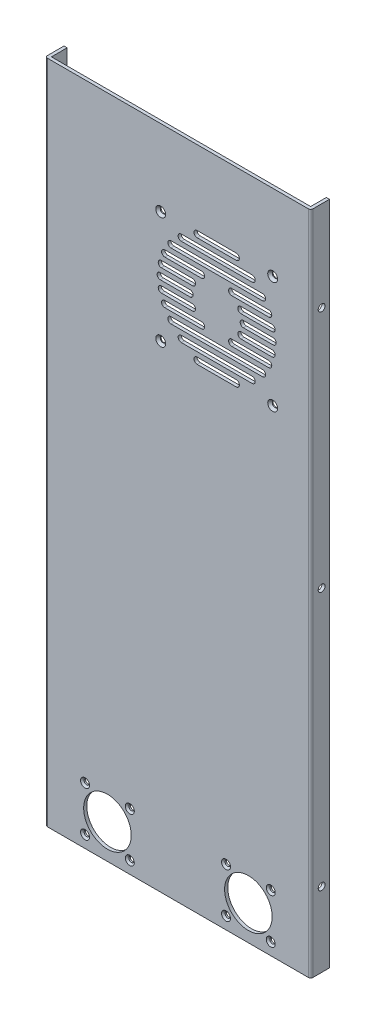
from build123d import *

# Parameters (mm, degrees)
EXTRUDE_THIN1_DEPTH                               = 425
SKETCH2_R                                         = 1
SKETCH2_R_2                                       = 15.187
CUT_EXTRUDE1_DEPTH                                = 10
SKETCH3_R                                         = 2.195
CUT_EXTRUDE2_DEPTH                                = 458.71088036
CSK_FOR_4_FLAT_HEAD_MACHINE_SCREW_100_D           = 3.2639
CSK_FOR_4_FLAT_HEAD_MACHINE_SCREW_100_DEPTH       = 10
CSK_FOR_4_FLAT_HEAD_MACHINE_SCREW_100_CSINK_D     = 5.715
CSK_FOR_4_FLAT_HEAD_MACHINE_SCREW_100_CSINK_ANGLE = 100
CSK_FOR_4_FLAT_HEAD_MACHINE_SCREW_100_TIP         = 0.980574487
CSK_FOR_M3_FLAT_HEAD_MACHINE_SCREW1_D             = 3.4
CSK_FOR_M3_FLAT_HEAD_MACHINE_SCREW1_DEPTH         = 10
CSK_FOR_M3_FLAT_HEAD_MACHINE_SCREW1_CSINK_D       = 6.3
CSK_FOR_M3_FLAT_HEAD_MACHINE_SCREW1_CSINK_ANGLE   = 90
CSK_FOR_M3_FLAT_HEAD_MACHINE_SCREW1_TIP           = 1.021463052


with BuildPart() as part:
    # Sketch1 → Extrude-Thin1 (new body)
    with BuildSketch(Plane(origin=(0, 0, 0), x_dir=(1, 0, 0), z_dir=(0, 1, 0))):
        with BuildLine():
            Line((-84.75, 12), (-84.75, 1.5))
            ThreePointArc((-84.75, 1.5), (-84.310660172, 0.439339828), (-83.25, 0))
            Line((-83.25, 0), (83.25, 0))
            ThreePointArc((83.25, 0), (84.310660172, 0.439339828), (84.75, 1.5))
            Line((84.75, 1.5), (84.75, 12))
            Line((84.75, 12), (82.75, 12))
            Line((82.75, 12), (82.75, 2))
            Line((82.75, 2), (-82.75, 2))
            Line((-82.75, 2), (-82.75, 12))
            Line((-82.75, 12), (-84.75, 12))
        make_face()
    extrude(amount=EXTRUDE_THIN1_DEPTH)

    # Sketch2 → Cut-Extrude1 (cut)
    with BuildSketch(Plane(origin=(0, 0, -2), x_dir=(-1, 0, 0), z_dir=(0, 0, -1))):
        with Locations((-60.5, 376.25)):
            Circle(SKETCH2_R)
        with Locations((11, 376.25)):
            Circle(SKETCH2_R)
        with Locations((-60.5, 304.75)):
            Circle(SKETCH2_R)
        with Locations((11, 304.75)):
            Circle(SKETCH2_R)
        with Locations((45, 22)):
            Circle(SKETCH2_R_2)
        with Locations((-45, 22)):
            Circle(SKETCH2_R_2)
        with Locations((-59.2875, 7.7125)):
            Circle(SKETCH2_R)
        with Locations((-30.7125, 7.7125)):
            Circle(SKETCH2_R)
        with Locations((-30.7125, 36.2875)):
            Circle(SKETCH2_R)
        with Locations((-59.2875, 36.2875)):
            Circle(SKETCH2_R)
        with Locations((30.7125, 36.2875)):
            Circle(SKETCH2_R)
        with Locations((59.2875, 36.2875)):
            Circle(SKETCH2_R)
        with Locations((59.2875, 7.7125)):
            Circle(SKETCH2_R)
        with Locations((30.7125, 7.7125)):
            Circle(SKETCH2_R)
        with BuildLine():
            Line((-60.75, 342.5), (-41.75, 342.5))
            ThreePointArc((-41.75, 342.5), (-39.75, 340.5), (-41.75, 338.5))
            Line((-41.75, 338.5), (-60.75, 338.5))
            ThreePointArc((-60.75, 338.5), (-62.75, 340.5), (-60.75, 342.5))
        make_face()
        with BuildLine():
            Line((-7.75, 342.5), (11.25, 342.5))
            ThreePointArc((11.25, 342.5), (13.25, 340.5), (11.25, 338.5))
            Line((11.25, 338.5), (-7.75, 338.5))
            ThreePointArc((-7.75, 338.5), (-9.75, 340.5), (-7.75, 342.5))
        make_face()
        with BuildLine():
            Line((-60.062887166, 349.5), (-40.241933385, 349.5))
            ThreePointArc((-40.241933385, 349.5), (-38.241933385, 347.5), (-40.241933385, 345.5))
            Line((-40.241933385, 345.5), (-60.062887166, 345.5))
            ThreePointArc((-60.062887166, 345.5), (-62.062887166, 347.5), (-60.062887166, 349.5))
        make_face()
        with BuildLine():
            Line((-57.916247904, 356.5), (-34.393650761, 356.5))
            ThreePointArc((-34.393650761, 356.5), (-32.393650761, 354.5), (-34.393650761, 352.5))
            Line((-34.393650761, 352.5), (-57.916247904, 352.5))
            ThreePointArc((-57.916247904, 352.5), (-59.916247904, 354.5), (-57.916247904, 356.5))
        make_face()
        with BuildLine():
            Line((-9.258066615, 349.5), (10.562887166, 349.5))
            ThreePointArc((10.562887166, 349.5), (12.562887166, 347.5), (10.562887166, 345.5))
            Line((10.562887166, 345.5), (-9.258066615, 345.5))
            ThreePointArc((-9.258066615, 345.5), (-11.258066615, 347.5), (-9.258066615, 349.5))
        make_face()
        with BuildLine():
            Line((-15.106349239, 356.5), (8.416247904, 356.5))
            ThreePointArc((8.416247904, 356.5), (10.416247904, 354.5), (8.416247904, 352.5))
            Line((8.416247904, 352.5), (-15.106349239, 352.5))
            ThreePointArc((-15.106349239, 352.5), (-17.106349239, 354.5), (-15.106349239, 356.5))
        make_face()
        with BuildLine():
            Line((-9.258066615, 335.5), (10.562887166, 335.5))
            ThreePointArc((10.562887166, 335.5), (12.562887166, 333.5), (10.562887166, 331.5))
            Line((10.562887166, 331.5), (-9.258066615, 331.5))
            ThreePointArc((-9.258066615, 331.5), (-11.258066615, 333.5), (-9.258066615, 335.5))
        make_face()
        with BuildLine():
            Line((-15.106349239, 328.5), (8.416247904, 328.5))
            ThreePointArc((8.416247904, 328.5), (10.416247904, 326.5), (8.416247904, 324.5))
            Line((8.416247904, 324.5), (-15.106349239, 324.5))
            ThreePointArc((-15.106349239, 324.5), (-17.106349239, 326.5), (-15.106349239, 328.5))
        make_face()
        with BuildLine():
            Line((-60.062887166, 335.5), (-40.241933385, 335.5))
            ThreePointArc((-40.241933385, 335.5), (-38.241933385, 333.5), (-40.241933385, 331.5))
            Line((-40.241933385, 331.5), (-60.062887166, 331.5))
            ThreePointArc((-60.062887166, 331.5), (-62.062887166, 333.5), (-60.062887166, 335.5))
        make_face()
        with BuildLine():
            Line((-57.916247904, 328.5), (-34.393650761, 328.5))
            ThreePointArc((-34.393650761, 328.5), (-32.393650761, 326.5), (-34.393650761, 324.5))
            Line((-34.393650761, 324.5), (-57.916247904, 324.5))
            ThreePointArc((-57.916247904, 324.5), (-59.916247904, 326.5), (-57.916247904, 328.5))
        make_face()
        with BuildLine():
            Line((-53.990383034, 363.5), (4.490383034, 363.5))
            ThreePointArc((4.490383034, 363.5), (6.490383034, 361.5), (4.490383034, 359.5))
            Line((4.490383034, 359.5), (-53.990383034, 359.5))
            ThreePointArc((-53.990383034, 359.5), (-55.990383034, 361.5), (-53.990383034, 363.5))
        make_face()
        with BuildLine():
            Line((-47.377416998, 370.5), (-2.122583002, 370.5))
            ThreePointArc((-2.122583002, 370.5), (-0.122583002, 368.5), (-2.122583002, 366.5))
            Line((-2.122583002, 366.5), (-47.377416998, 366.5))
            ThreePointArc((-47.377416998, 366.5), (-49.377416998, 368.5), (-47.377416998, 370.5))
        make_face()
        with BuildLine():
            Line((-37.25, 377.5), (-12.25, 377.5))
            ThreePointArc((-12.25, 377.5), (-10.25, 375.5), (-12.25, 373.5))
            Line((-12.25, 373.5), (-37.25, 373.5))
            ThreePointArc((-37.25, 373.5), (-39.25, 375.5), (-37.25, 377.5))
        make_face()
        with BuildLine():
            Line((-53.990383034, 321.5), (4.490383034, 321.5))
            ThreePointArc((4.490383034, 321.5), (6.490383034, 319.5), (4.490383034, 317.5))
            Line((4.490383034, 317.5), (-53.990383034, 317.5))
            ThreePointArc((-53.990383034, 317.5), (-55.990383034, 319.5), (-53.990383034, 321.5))
        make_face()
        with BuildLine():
            Line((-47.377416998, 314.5), (-2.122583002, 314.5))
            ThreePointArc((-2.122583002, 314.5), (-0.122583002, 312.5), (-2.122583002, 310.5))
            Line((-2.122583002, 310.5), (-47.377416998, 310.5))
            ThreePointArc((-47.377416998, 310.5), (-49.377416998, 312.5), (-47.377416998, 314.5))
        make_face()
        with BuildLine():
            Line((-37.25, 307.5), (-12.25, 307.5))
            ThreePointArc((-12.25, 307.5), (-10.25, 305.5), (-12.25, 303.5))
            Line((-12.25, 303.5), (-37.25, 303.5))
            ThreePointArc((-37.25, 303.5), (-39.25, 305.5), (-37.25, 307.5))
        make_face()
    extrude(amount=-CUT_EXTRUDE1_DEPTH, mode=Mode.SUBTRACT)

    # Sketch3 → Cut-Extrude2 (cut, through all)
    with BuildSketch(Plane.ZY.offset(84.75)):
        with Locations((-7, 367.5)):
            Circle(SKETCH3_R)
        with Locations((-7, 212.5)):
            Circle(SKETCH3_R)
        with Locations((-7, 47.5)):
            Circle(SKETCH3_R)
    extrude(amount=-CUT_EXTRUDE2_DEPTH, mode=Mode.SUBTRACT)

    # CSK for #4 Flat Head Machine Screw (100)1
    with Locations(Plane.XY):
        with Locations((-59.2875, 36.2875), (-59.2875, 7.7125), (-30.7125, 7.7125), (-30.7125, 36.2875), (30.7125, 36.2875), (59.2875, 36.2875), (59.2875, 7.7125), (30.7125, 7.7125)):
            CounterSinkHole(CSK_FOR_4_FLAT_HEAD_MACHINE_SCREW_100_D / 2, CSK_FOR_4_FLAT_HEAD_MACHINE_SCREW_100_CSINK_D / 2, depth=CSK_FOR_4_FLAT_HEAD_MACHINE_SCREW_100_DEPTH, counter_sink_angle=CSK_FOR_4_FLAT_HEAD_MACHINE_SCREW_100_CSINK_ANGLE)
            with Locations((0, 0, -(CSK_FOR_4_FLAT_HEAD_MACHINE_SCREW_100_DEPTH + CSK_FOR_4_FLAT_HEAD_MACHINE_SCREW_100_TIP / 2))):  # 118° drill point
                Cone(0, CSK_FOR_4_FLAT_HEAD_MACHINE_SCREW_100_D / 2, CSK_FOR_4_FLAT_HEAD_MACHINE_SCREW_100_TIP, mode=Mode.SUBTRACT)

    # CSK for M3 Flat Head Machine Screw1
    with Locations(Plane.XY):
        with Locations((-11, 376.25), (60.5, 376.25), (60.5, 304.75), (-11, 304.75)):
            CounterSinkHole(CSK_FOR_M3_FLAT_HEAD_MACHINE_SCREW1_D / 2, CSK_FOR_M3_FLAT_HEAD_MACHINE_SCREW1_CSINK_D / 2, depth=CSK_FOR_M3_FLAT_HEAD_MACHINE_SCREW1_DEPTH, counter_sink_angle=CSK_FOR_M3_FLAT_HEAD_MACHINE_SCREW1_CSINK_ANGLE)
            with Locations((0, 0, -(CSK_FOR_M3_FLAT_HEAD_MACHINE_SCREW1_DEPTH + CSK_FOR_M3_FLAT_HEAD_MACHINE_SCREW1_TIP / 2))):  # 118° drill point
                Cone(0, CSK_FOR_M3_FLAT_HEAD_MACHINE_SCREW1_D / 2, CSK_FOR_M3_FLAT_HEAD_MACHINE_SCREW1_TIP, mode=Mode.SUBTRACT)


solid = part.part
